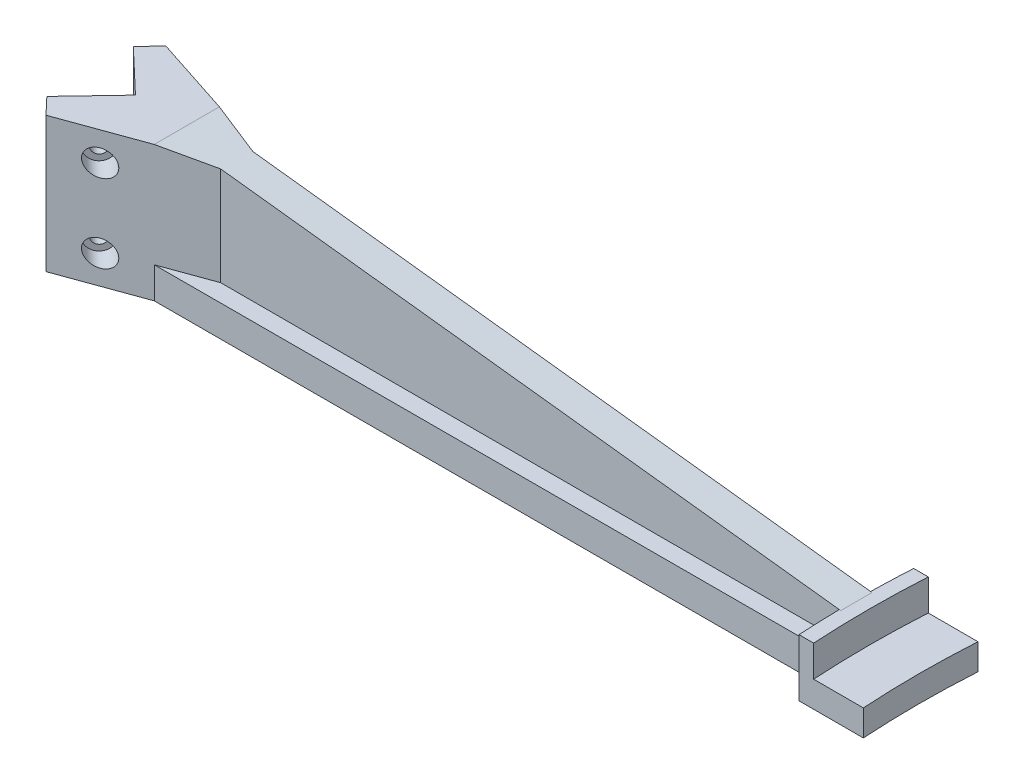
from build123d import *

# Parameters (mm, degrees)
BOSS_EXTRUDE2_DEPTH          = 12
BOSS_EXTRUDE3_START          = -2
BOSS_EXTRUDE3_DEPTH          = 10
BOSS_EXTRUDE4_START          = 10
BOSS_EXTRUDE4_DEPTH          = 22
BOSS_EXTRUDE7_DEPTH          = 40
BOSS_EXTRUDE17_DEPTH         = 6
BOSS_EXTRUDE17_DEPTH_BACK    = 6
CUT_EXTRUDE_THIN1_DEPTH      = 297.279628574
CUT_EXTRUDE_THIN1_DEPTH_BACK = 297.279628574
CUT_EXTRUDE1_START           = -8
SKETCH6_R                    = 5
CUT_EXTRUDE1_DEPTH           = 231.29743947
SKETCH6_4_R                  = 2.75
CUT_EXTRUDE2_DEPTH           = 239.29743947


with BuildPart() as part:
    # Sketch2 → Boss-Extrude2 (new body)
    with BuildSketch(Plane(origin=(0, 0, 0), x_dir=(1, 0, 0), z_dir=(0, 1, 0))):
        with BuildLine():
            Line((-292.596610314, 15.743442535), (-276.02456554, 0))
            Line((-276.02456554, 0), (-292.596610314, -17.444257657))
            Line((-292.596610314, -17.444257657), (-286.510767905, -23.850407561))
            Line((-286.510767905, -23.850407561), (-256.02456554, -12.789688675))
            Line((-256.02456554, -12.789688675), (0.21086679, -12.5))
            ThreePointArc((0.21086679, -12.5), (0.401744327, -17.25142014), (0.653571446, -22))
            Line((0.653571446, -22), (6.263616969, -22))
            ThreePointArc((6.263616969, -22), (5.6, 0), (6.263616969, 22))
            Line((6.263616969, 22), (0.653571446, 22))
            ThreePointArc((0.653571446, 22), (0.401744327, 17.25142014), (0.21086679, 12.5))
            Line((0.21086679, 12.5), (-256.02456554, 12.210311325))
            Line((-256.02456554, 12.210311325), (-286.510767905, 22.149592439))
            Line((-286.510767905, 22.149592439), (-292.596610314, 15.743442535))
        make_face()
    extrude(amount=-BOSS_EXTRUDE2_DEPTH)

    # Sketch2<5> → Boss-Extrude3 (add)
    with BuildSketch(Plane(origin=(0, 0, 0), x_dir=(1, 0, 0), z_dir=(0, 1, 0)).offset(BOSS_EXTRUDE3_START)):
        with BuildLine():
            Line((25.340211435, 22), (6.263616969, 22))
            ThreePointArc((6.263616969, 22), (5.6, 0), (6.263616969, -22))
            Line((6.263616969, -22), (25.340211435, -22))
            ThreePointArc((25.340211435, -22), (24.64, 0), (25.340211435, 22))
        make_face()
    extrude(amount=-BOSS_EXTRUDE3_DEPTH)

    # Sketch2<6> → Boss-Extrude4 (add)
    with BuildSketch(Plane(origin=(0, 0, 0), x_dir=(1, 0, 0), z_dir=(0, 1, 0)).offset(BOSS_EXTRUDE4_START)):
        with BuildLine():
            ThreePointArc((0.653571446, 22), (0.401744327, 17.25142014), (0.21086679, 12.5))
            ThreePointArc((0.21086679, 12.5), (0, 0), (0.21086679, -12.5))
            ThreePointArc((0.21086679, -12.5), (0.401744327, -17.25142014), (0.653571446, -22))
            Line((0.653571446, -22), (6.263616969, -22))
            ThreePointArc((6.263616969, -22), (5.6, 0), (6.263616969, 22))
            Line((6.263616969, 22), (0.653571446, 22))
        make_face()
    extrude(amount=-BOSS_EXTRUDE4_DEPTH)

    # Sketch2<9> → Boss-Extrude7 (add)
    with BuildSketch(Plane(origin=(0, 0, 0), x_dir=(1, 0, 0), z_dir=(0, 1, 0))):
        Polygon((-292.596610314, 15.743442535), (-276.02456554, 0), (-292.596610314, -17.444257657), (-286.510767905, -23.850407561), (-219.731467486, 0.377833809), (-286.510767905, 22.149592439), align=None)
    extrude(amount=BOSS_EXTRUDE7_DEPTH)

    # Sketch4 → Boss-Extrude17 (add, two sides: drawn at the far end of the back side and taken through both)
    with BuildSketch(Plane.XY.offset(-BOSS_EXTRUDE17_DEPTH_BACK)):
        Polygon((0.653571446, 10), (-256.02456554, 40), (-256.02456554, 0), (0.653571446, 0), align=None)
    extrude(amount=BOSS_EXTRUDE17_DEPTH + BOSS_EXTRUDE17_DEPTH_BACK)

    # Sketch5 → Cut-Extrude-Thin1 (cut, two sides: drawn at the far end of the back side and taken through both)
    with BuildSketch(Plane.XY.offset(-CUT_EXTRUDE_THIN1_DEPTH_BACK)):
        Polygon((0.653571446, 10), (-256.02456554, 40), (-254.863688753, 49.932389697), (1.814448233, 19.932389697), align=None)
    extrude(amount=CUT_EXTRUDE_THIN1_DEPTH + CUT_EXTRUDE_THIN1_DEPTH_BACK, mode=Mode.SUBTRACT)

    # Sketch6 → Cut-Extrude1 (cut, through all)
    with BuildSketch(Plane(origin=(-145.085185566, 0, -137.830926288), x_dir=(-0.6887494619146907, 0, 0.724999433594416), z_dir=(-0.724999433594416, 0, -0.6887494619146907)).offset(CUT_EXTRUDE1_START)):
        with Locations((200.111770991, 29)):
            Circle(SKETCH6_R)
        with Locations((200.111770991, -1)):
            Circle(SKETCH6_R)
    cut_extrude1 = extrude(amount=-CUT_EXTRUDE1_DEPTH, mode=Mode.SUBTRACT)

    # Sketch6<4> → Cut-Extrude2 (cut, symmetric)
    with BuildSketch(Plane(origin=(-145.085185566, 0, -137.830926288), x_dir=(-0.6887494619146907, 0, 0.724999433594416), z_dir=(-0.724999433594416, 0, -0.6887494619146907))):
        with Locations((200.111770991, 29)):
            Circle(SKETCH6_4_R)
        with Locations((200.111770991, -1)):
            Circle(SKETCH6_4_R)
    cut_extrude2 = extrude(amount=CUT_EXTRUDE2_DEPTH, both=True, mode=Mode.SUBTRACT)

    # Mirror1: Cut-Extrude1, Cut-Extrude2 across plane
    add(cut_extrude1.mirror(Plane.XY), mode=Mode.SUBTRACT)
    add(cut_extrude2.mirror(Plane.XY), mode=Mode.SUBTRACT)


solid = part.part
